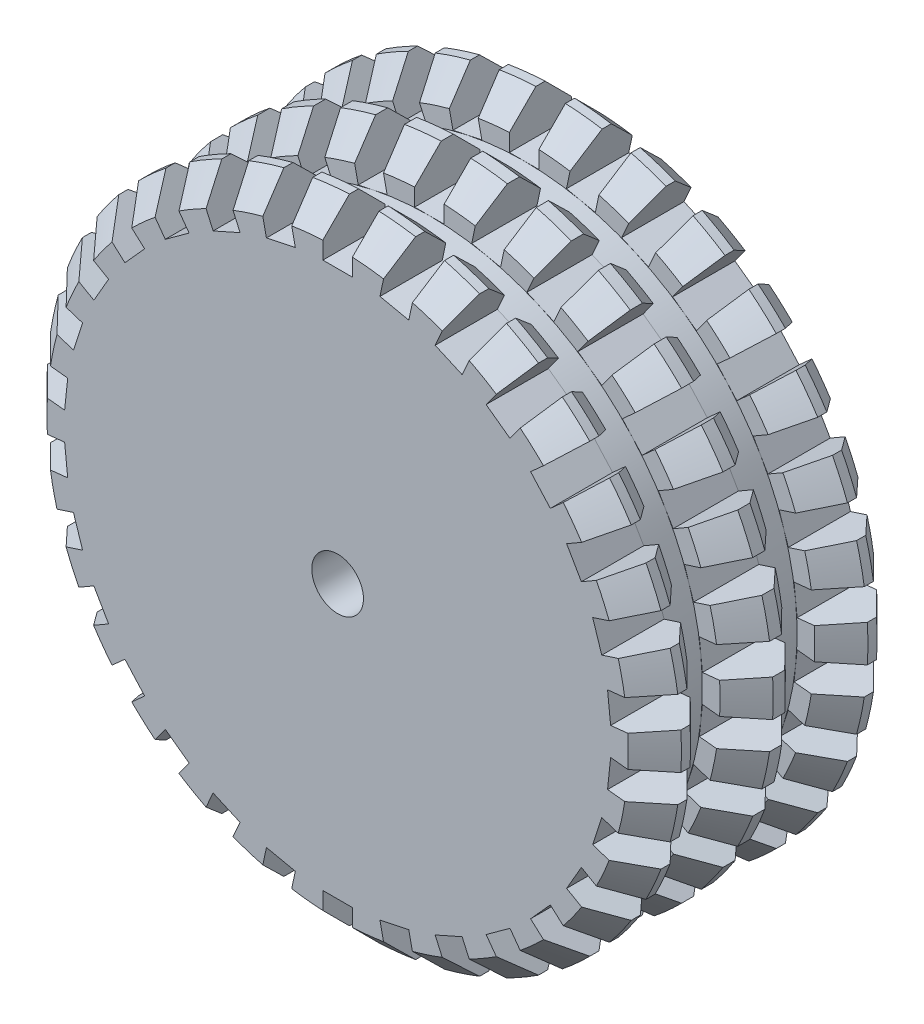
from build123d import *

# Parameters (mm, degrees)
SKETCH1_R             = 21.5
SKETCH1_R_2           = 1.75
BOSS_EXTRUDE1_DEPTH   = 16.86
CROQUIS1_W            = 2
CROQUIS1_H            = 4
CORTAR_EXTRUIR1_DEPTH = 35.767220194
CROQUIS2_R            = 21.5
CROQUIS2_R_2          = 18.5
CORTAR_EXTRUIR2_DEPTH = 1
CROQUIS3_R            = 21.5
CROQUIS3_R_2          = 18.5
CORTAR_EXTRUIR3_DEPTH = 1
CHAFL_N1_SIZE         = 1.8
MATRIZC1_COUNT        = 30


with BuildPart() as part:
    # Sketch1 → Boss-Extrude1 (new body)
    with BuildSketch(Plane.XY):
        Circle(SKETCH1_R)
        Circle(SKETCH1_R_2, mode=Mode.SUBTRACT)
    extrude(amount=BOSS_EXTRUDE1_DEPTH)

    # Croquis1 → Cortar-Extruir1 (cut, through all)
    with BuildSketch(Plane.XY.offset(16.86)):
        with Locations((0, 20.5)):
            Rectangle(CROQUIS1_W, CROQUIS1_H)
    cortar_extruir1 = extrude(amount=-CORTAR_EXTRUIR1_DEPTH, mode=Mode.SUBTRACT)

    # Croquis2 → Cortar-Extruir2 (cut, symmetric)
    with BuildSketch(Plane.XY.offset(11.64)):
        Circle(CROQUIS2_R)
        with Locations(Location((0, 0, 0), (0, 0, 90))):
            Circle(CROQUIS2_R_2, mode=Mode.SUBTRACT)
    extrude(amount=CORTAR_EXTRUIR2_DEPTH, both=True, mode=Mode.SUBTRACT)

    # Croquis3 → Cortar-Extruir3 (cut, symmetric)
    with BuildSketch(Plane(origin=(0, 0, 5.22), x_dir=(-1, 0, 0), z_dir=(0, 0, -1))):
        Circle(CROQUIS3_R)
        with Locations(Location((0, 0, 0), (0, 0, 90))):
            Circle(CROQUIS3_R_2, mode=Mode.SUBTRACT)
    extrude(amount=CORTAR_EXTRUIR3_DEPTH, both=True, mode=Mode.SUBTRACT)

    # Chaflán1
    chafl_n1_edges = [part.edges().sort_by_distance(p)[0] for p in [
        (-14.845032839, -15.552331015, 0),
        (-14.845032839, -15.552331015, 10.64),
        (-14.845032839, -15.552331015, 12.64),
        (-14.845032839, -15.552331015, 6.22),
        (-14.845032839, -15.552331015, 4.22),
        (-14.845032839, -15.552331015, 16.86),
    ]]
    chamfer(chafl_n1_edges, length=CHAFL_N1_SIZE)

    # MatrizC1: Cortar-Extruir1 ×30 about axis
    matrizc1_axis = Axis((0, 0, 0), (0, 0, 1))
    for i in range(1, MATRIZC1_COUNT):
        add(cortar_extruir1.rotate(matrizc1_axis, i * 360 / MATRIZC1_COUNT), mode=Mode.SUBTRACT)


solid = part.part
